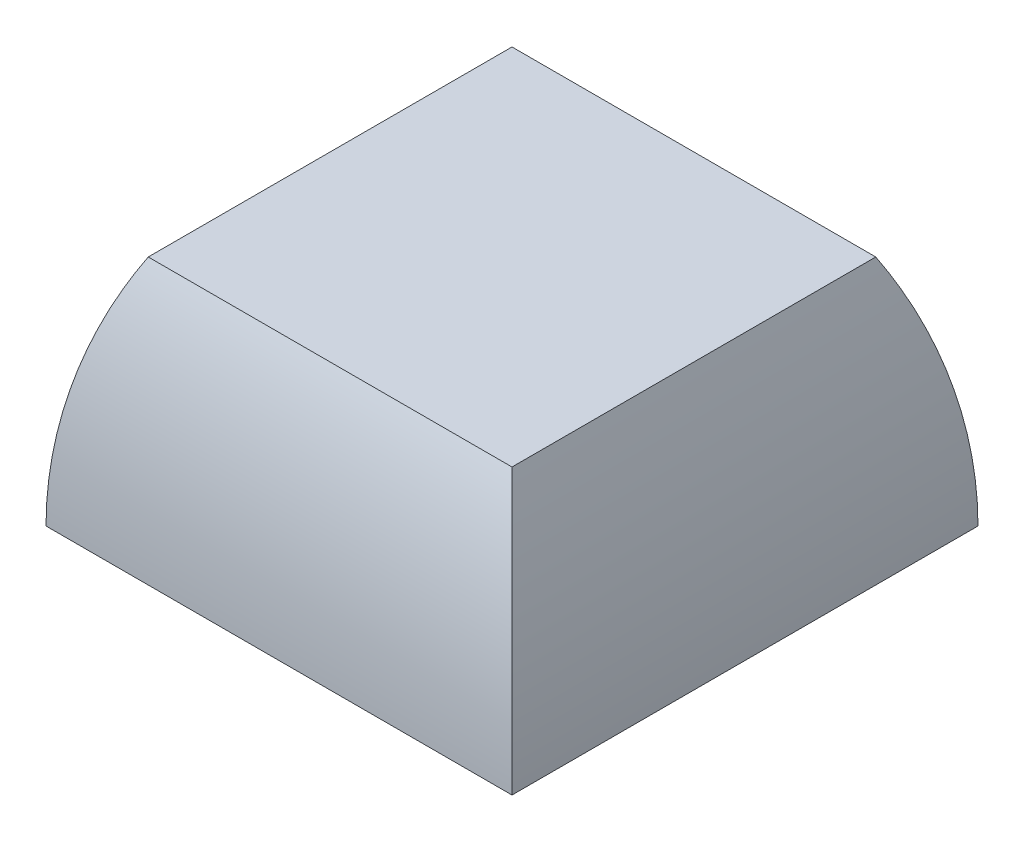
from build123d import *

# Parameters (mm, degrees)
SKETCH1_W               = 15
SKETCH1_H               = 15
BOSS_EXTRUDE1_DEPTH     = 7.5
CUT_EXTRUDE1_DEPTH      = 13.990381057
CUT_EXTRUDE1_DEPTH_BACK = 13.990381057
CUT_EXTRUDE2_DEPTH      = 13.99038123
CUT_EXTRUDE2_DEPTH_BACK = 13.99038123
SKETCH1_3_W             = 13
SKETCH1_3_H             = 13
SKETCH1_3_R             = 2
CUT_EXTRUDE3_DEPTH      = 5


with BuildPart() as part:
    # Sketch1 → Boss-Extrude1 (new body)
    with BuildSketch(Plane(origin=(0, 0, 0), x_dir=(1, 0, 0), z_dir=(0, 1, 0))):
        Rectangle(SKETCH1_W, SKETCH1_H)
    extrude(amount=BOSS_EXTRUDE1_DEPTH)

    # Sketch2 → Cut-Extrude1 (cut, two sides: drawn at the far end of the back side and taken through both)
    with BuildSketch(Plane.XY.offset(-CUT_EXTRUDE1_DEPTH_BACK)):
        with BuildLine():
            Line((-10, 12), (-10, 0))
            Line((-10, 0), (-7.5, 0))
            add(Edge.make_bspline(
                [(0, 12), (-7.5, 12), (-7.5, 0)],
                knots=[0, 0, 0, 1.570796327, 1.570796327, 1.570796327], degree=2, weights=[1, 0.707106781, 1]))
            Line((0, 12), (-10, 12))
        make_face()
        with BuildLine():
            add(Edge.make_bspline(
                [(7.5, 0), (7.5, 12), (0, 12)],
                knots=[4.71238898, 4.71238898, 4.71238898, 6.283185307, 6.283185307, 6.283185307], degree=2, weights=[1, 0.707106781, 1]))
            Line((7.5, 0), (10, 0))
            Line((10, 0), (10, 12))
            Line((10, 12), (0, 12))
        make_face()
    extrude(amount=CUT_EXTRUDE1_DEPTH + CUT_EXTRUDE1_DEPTH_BACK, mode=Mode.SUBTRACT)

    # Sketch3 → Cut-Extrude2 (cut, two sides: drawn at the far end of the back side and taken through both)
    with BuildSketch(Plane(origin=(0, 0, 0), x_dir=(0, 0, -1), z_dir=(1, 0, 0)).offset(-CUT_EXTRUDE2_DEPTH_BACK)):
        with BuildLine():
            Line((7.5, 0), (10, 0))
            Line((10, 0), (10, 12))
            Line((10, 12), (0, 12))
            add(Edge.make_bspline(
                [(7.5, 0), (7.5, 12), (0, 12)],
                knots=[1.570796327, 1.570796327, 1.570796327, 3.141592654, 3.141592654, 3.141592654], degree=2, weights=[1, 0.707106781, 1]))
        make_face()
        with BuildLine():
            Line((-10, 0), (-7.5, 0))
            add(Edge.make_bspline(
                [(0, 12), (-7.5, 12), (-7.5, 0)],
                knots=[3.141592654, 3.141592654, 3.141592654, 4.71238898, 4.71238898, 4.71238898], degree=2, weights=[1, 0.707106781, 1]))
            Line((0, 12), (-10, 12))
            Line((-10, 12), (-10, 0))
        make_face()
    extrude(amount=CUT_EXTRUDE2_DEPTH + CUT_EXTRUDE2_DEPTH_BACK, mode=Mode.SUBTRACT)

    # Sketch1<3> → Cut-Extrude3 (cut)
    with BuildSketch(Plane(origin=(0, 0, 0), x_dir=(1, 0, 0), z_dir=(0, 1, 0))):
        Rectangle(SKETCH1_3_W, SKETCH1_3_H)
        Circle(SKETCH1_3_R, mode=Mode.SUBTRACT)
    extrude(amount=CUT_EXTRUDE3_DEPTH, mode=Mode.SUBTRACT)


solid = part.part
